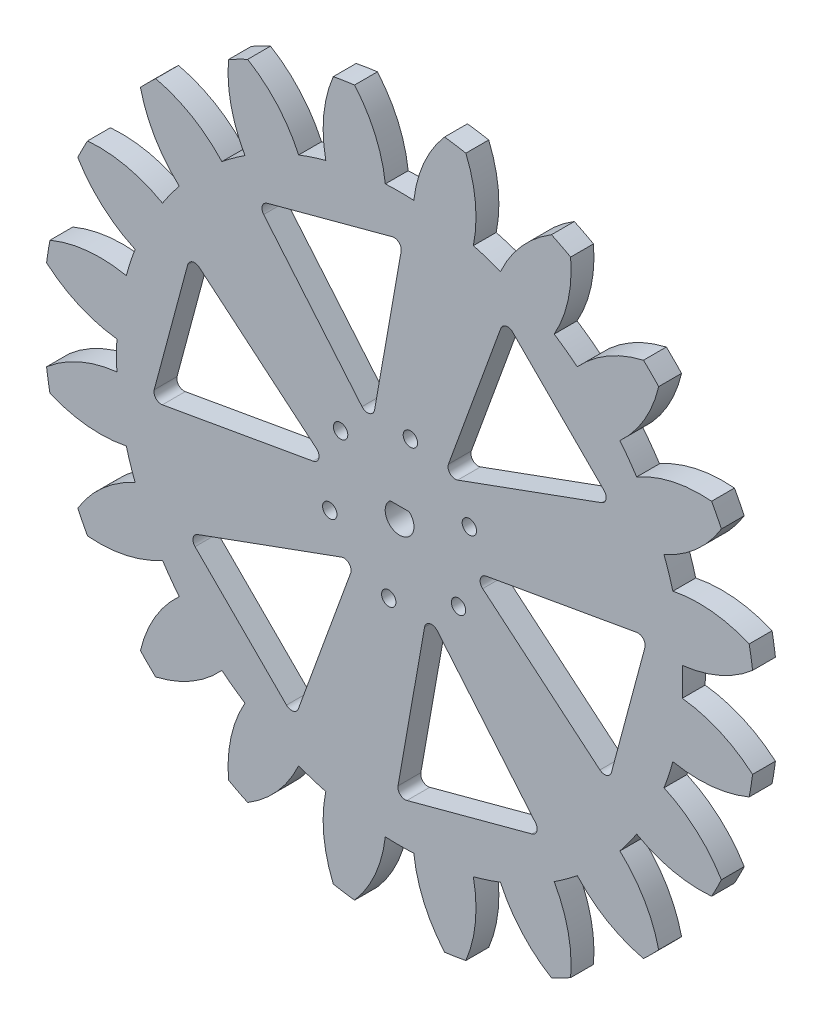
from build123d import *

# Parameters (mm, degrees)
SKETCH1_R                = 49.5
BOSS_EXTRUDE1_DEPTH      = 3.18
CUT_EXTRUDE1_START       = -3.18
CUT_EXTRUDE1_DEPTH       = 3.18
CIRPATTERN1_COUNT        = 20
CUT_EXTRUDE2_DEPTH       = 70.51411196
FILLET2_R                = 1
CIRPATTERN2_COUNT        = 6
FILLET2_OF_CIRPATTERN2_R = 1
CUT_EXTRUDE3_DEPTH       = 70.51411196
SKETCH7_R                = 1
CUT_EXTRUDE4_DEPTH       = 70.51411196
CIRPATTERN3_COUNT        = 6


with BuildPart() as part:
    # Sketch1 → Boss-Extrude1 (new body)
    with BuildSketch(Plane.XY):
        with Locations(Location((0, 0, 0), (0, 0, 180))):
            Circle(SKETCH1_R)
    extrude(amount=BOSS_EXTRUDE1_DEPTH)

    # Sketch2 → Cut-Extrude1 (cut)
    with BuildSketch(Plane.XY.offset(3.18).offset(CUT_EXTRUDE1_START)):
        with BuildLine():
            ThreePointArc((-6.261015826, 49.102440681), (-3.38164679, 44.537884692), (-1.984798992, 39.324943712))
            ThreePointArc((-1.984798992, 39.324943712), (0, 39.375), (1.984798992, 39.324943712))
            ThreePointArc((1.984798992, 39.324943712), (3.38164679, 44.537884692), (6.261015826, 49.102440681))
            ThreePointArc((6.261015826, 49.102440681), (0, 49.5), (-6.261015826, 49.102440681))
        make_face()
    cut_extrude1 = extrude(amount=CUT_EXTRUDE1_DEPTH, mode=Mode.SUBTRACT)

    # CirPattern1: Cut-Extrude1 ×20 about axis
    cirpattern1_axis = Axis((0, 0, 0), (0, 0, 1))
    for i in range(1, CIRPATTERN1_COUNT):
        add(cut_extrude1.rotate(cirpattern1_axis, i * 360 / CIRPATTERN1_COUNT), mode=Mode.SUBTRACT)

    # Sketch3 → Cut-Extrude2 (cut, through all)
    with BuildSketch(Plane.XY.offset(3.18)):
        Polygon((6.06887616, 7.947876581), (29.56119168, 16.498380165), (14.619379743, 31.440192101), align=None)
    cut_extrude2 = extrude(amount=-CUT_EXTRUDE2_DEPTH, mode=Mode.SUBTRACT)

    # Fillet2
    fillet2_edges = [part.edges().sort_by_distance(p)[0] for p in [
        (29.56119168, 16.498380165, 1.59),
        (6.06887616, 7.947876581, 1.59),
        (14.619379743, 31.440192101, 1.59),
    ]]
    fillet(fillet2_edges, radius=FILLET2_R)

    # CirPattern2: Cut-Extrude2 ×6 about axis
    cirpattern2_axis = Axis((0, 0, 0), (0, 0, 1))
    for i in range(1, CIRPATTERN2_COUNT):
        add(cut_extrude2.rotate(cirpattern2_axis, i * 360 / CIRPATTERN2_COUNT), mode=Mode.SUBTRACT)

    # Fillet2 of CirPattern2
    fillet2_of_cirpattern2_edges = [part.edges().sort_by_distance(p)[0] for p in [
        (0.492579496, 33.849933043, 1.59),
        (-3.848624946, 9.229739218, 1.59),
        (-19.918315188, 28.380850296, 1.59),
        (-29.068612184, 17.351552878, 1.59),
        (-9.917501106, 1.281862636, 1.59),
        (-34.537694931, -3.059341805, 1.59),
        (-29.56119168, -16.498380165, 1.59),
        (-6.06887616, -7.947876581, 1.59),
        (-14.619379743, -31.440192101, 1.59),
        (-0.492579496, -33.849933043, 1.59),
        (3.848624946, -9.229739218, 1.59),
        (19.918315188, -28.380850296, 1.59),
        (29.068612184, -17.351552878, 1.59),
        (9.917501106, -1.281862636, 1.59),
        (34.537694931, 3.059341805, 1.59),
    ]]
    fillet(fillet2_of_cirpattern2_edges, radius=FILLET2_OF_CIRPATTERN2_R)

    # Sketch5 → Cut-Extrude3 (cut, through all)
    with BuildSketch(Plane.XY.offset(3.18)):
        with BuildLine():
            Line((-1.322875656, 1.5), (1.322875656, 1.5))
            ThreePointArc((1.322875656, 1.5), (0, -2), (-1.322875656, 1.5))
        make_face()
    extrude(amount=-CUT_EXTRUDE3_DEPTH, mode=Mode.SUBTRACT)

    # Sketch7 → Cut-Extrude4 (cut, through all)
    with BuildSketch(Plane(origin=(0, 0, 0), x_dir=(-1, 0, 0), z_dir=(0, 0, -1))):
        with Locations((-1.505042839, 10.341051496)):
            Circle(SKETCH7_R)
    cut_extrude4 = extrude(amount=-CUT_EXTRUDE4_DEPTH, mode=Mode.SUBTRACT)

    # CirPattern3: Cut-Extrude4 ×6 about axis
    cirpattern3_axis = Axis((0, 0, 0), (0, 0, 1))
    for i in range(1, CIRPATTERN3_COUNT):
        add(cut_extrude4.rotate(cirpattern3_axis, i * 360 / CIRPATTERN3_COUNT), mode=Mode.SUBTRACT)


solid = part.part
